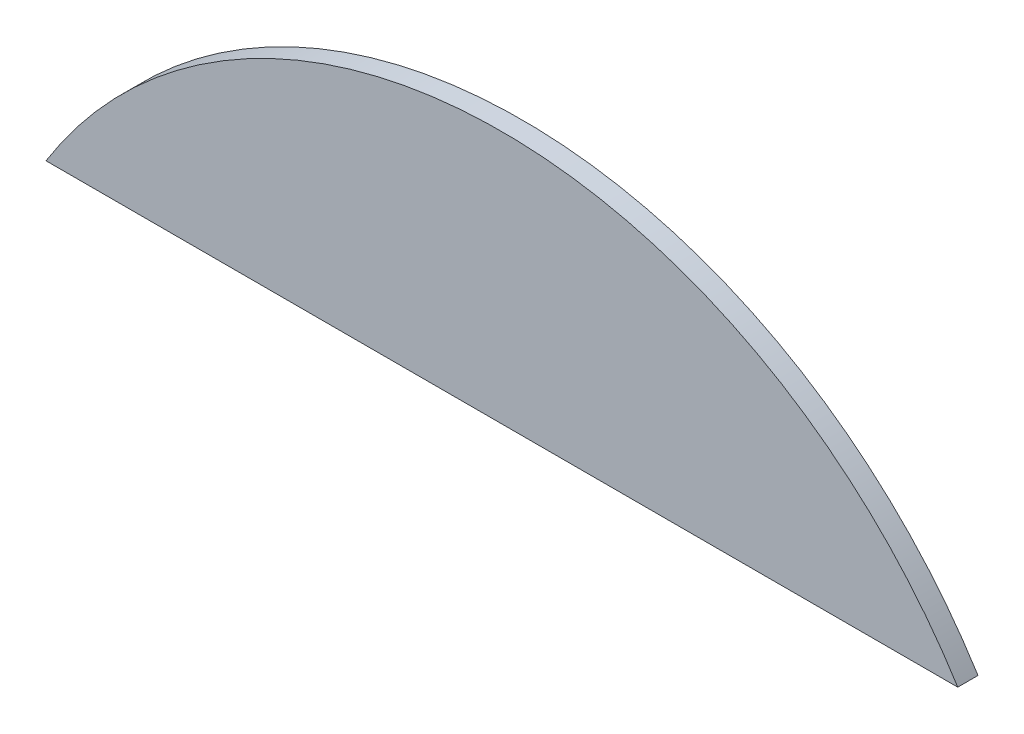
from build123d import *

# Parameters (mm, degrees)
BOSS_EXTRUDE1_DEPTH = 1


with BuildPart() as part:
    # Sketch1 → Boss-Extrude1 (new, symmetric)
    with BuildSketch(Plane.XY):
        with BuildLine():
            Line((-45, 0), (45, 0))
            ThreePointArc((45, 0), (0, 25), (-45, 0))
        make_face()
    extrude(amount=BOSS_EXTRUDE1_DEPTH, both=True)


solid = part.part
